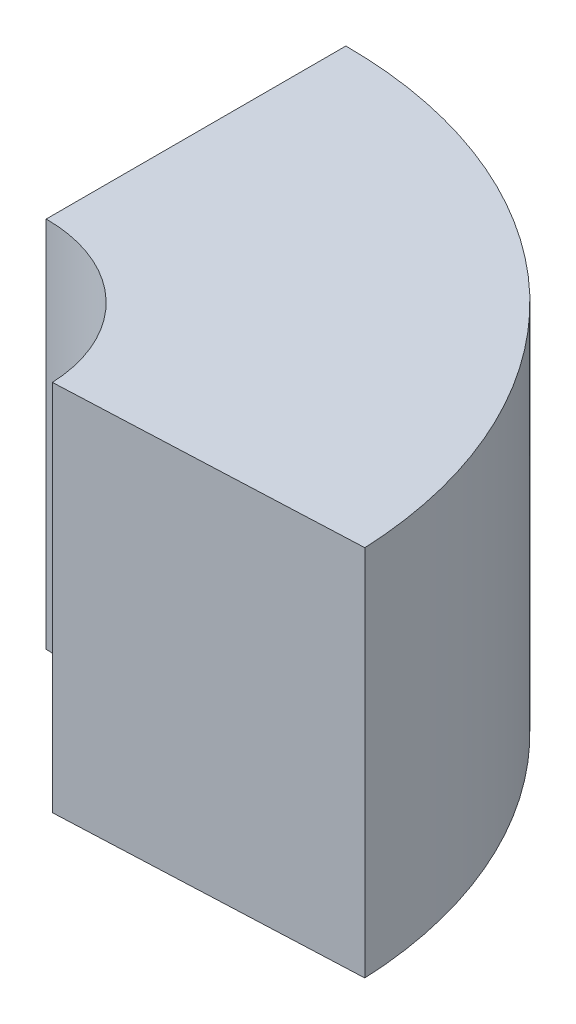
from build123d import *

# Parameters (mm, degrees)
REVOLVESKETCH_W           = 23.4
REVOLVESKETCH_H           = 29.1
ORDINARYBOSSREVOLVE_ANGLE = 87.5


with BuildPart() as part:
    # RevolveSketch → OrdinaryBossRevolve (revolve)
    with BuildSketch(Plane(origin=(0, 0, 0), x_dir=(0, 0, -1), z_dir=(1, 0, 0))):
        with Locations((32.3, -2.35)):
            Rectangle(REVOLVESKETCH_W, REVOLVESKETCH_H)
    revolve(axis=Axis((0, -21.9, -9.3), (0, -1, 0)), revolution_arc=ORDINARYBOSSREVOLVE_ANGLE)


solid = part.part
